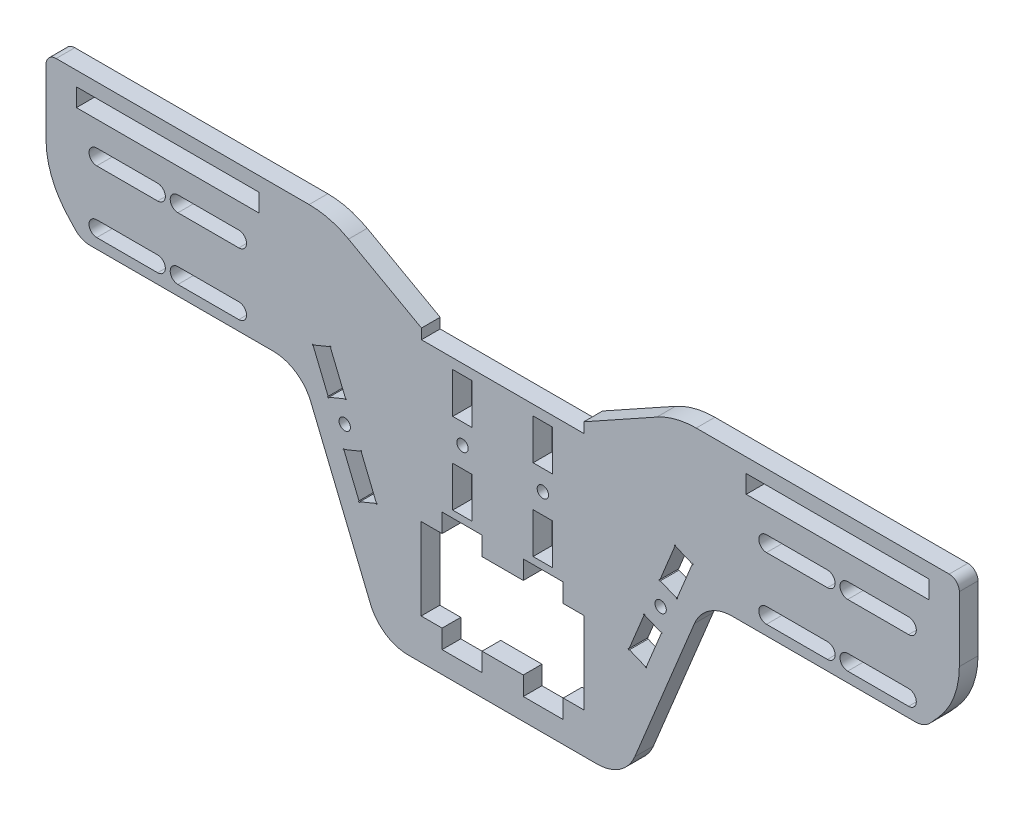
from build123d import *

# Parameters (mm, degrees)
SKETCH1_W           = 57.15
SKETCH1_H           = 5.641999892
BOSS_EXTRUDE1_DEPTH = 5.842
FILLET1_R           = 12.7
FILLET2_R           = 6.35
FILLET3_R           = 25.4
FILLET4_R           = 3.175
FILLET5_R           = 25.4
SKETCH2_R           = 1.778
SKETCH2_W           = 6.096
SKETCH2_H           = 12.7
CUT_EXTRUDE1_DEPTH  = 165.420046831
SKETCH4_W           = 5.842
SKETCH4_H           = 12.5
BOSS_EXTRUDE2_DEPTH = 5.842
SKETCH6_R           = 0.1984375
SKETCH6_R_2         = 1.778
CUT_EXTRUDE4_DEPTH  = 165.420046831


with BuildPart() as part:
    # Sketch1 → Boss-Extrude1 (new body)
    with BuildSketch(Plane.XY):
        Polygon((25.4, 65.274952), (53.975, 81.157607228), (142.875, 81.157607228), (142.875, 47.850552), (131.9276, 35.810952), (63.246, 35.810952), (38.099924, -25.399924), (-38.099924, -25.399924), (-63.246, 35.810952), (-131.9276, 35.810952), (-142.875, 47.850552), (-142.875, 81.157607228), (-53.975, 81.157607228), (-25.4, 65.274952), (-25.4, 62.099952), (25.4, 62.099952), align=None)
        Polygon((6.45, -12.8), (-6.45, -12.8), (-6.45, -18.642), (-18.95, -18.642), (-18.95, -12.8), (-25.5, -12.8), (-25.5, -6.25), (-31.342, -6.25), (-31.342, 6.25), (-25.5, 6.25), (-25.5, 12.8), (-18.95, 12.8), (-18.95, 18.642), (-6.45, 18.642), (-6.45, 12.8), (6.45, 12.8), (6.45, 18.642), (18.95, 18.642), (18.95, 12.8), (25.5, 12.8), (25.5, 6.25), (31.342, 6.25), (31.342, -6.25), (25.5, -6.25), (25.5, -12.8), (18.95, -12.8), (18.95, -18.642), (6.45, -18.642), align=None, mode=Mode.SUBTRACT)
        with BuildLine():
            Line((-82.55, 58.416952), (-101.6, 58.416952))
            ThreePointArc((-101.6, 58.416952), (-104.013, 60.829952), (-101.6, 63.242952))
            Line((-101.6, 63.242952), (-82.55, 63.242952))
            ThreePointArc((-82.55, 63.242952), (-80.137, 60.829952), (-82.55, 58.416952))
        make_face(mode=Mode.SUBTRACT)
        with BuildLine():
            Line((-107.95, 58.416952), (-127, 58.416952))
            ThreePointArc((-127, 58.416952), (-129.413, 60.829952), (-127, 63.242952))
            Line((-127, 63.242952), (-107.95, 63.242952))
            ThreePointArc((-107.95, 63.242952), (-105.537, 60.829952), (-107.95, 58.416952))
        make_face(mode=Mode.SUBTRACT)
        with Locations((-104.775, 73.836351946)):
            Rectangle(SKETCH1_W, SKETCH1_H, mode=Mode.SUBTRACT)
        with BuildLine():
            Line((-82.55, 38.985952), (-101.6, 38.985952))
            ThreePointArc((-101.6, 38.985952), (-104.013, 41.398952), (-101.6, 43.811952))
            Line((-101.6, 43.811952), (-82.55, 43.811952))
            ThreePointArc((-82.55, 43.811952), (-80.137, 41.398952), (-82.55, 38.985952))
        make_face(mode=Mode.SUBTRACT)
        with BuildLine():
            Line((-107.95, 38.985952), (-127, 38.985952))
            ThreePointArc((-127, 38.985952), (-129.413, 41.398952), (-127, 43.811952))
            Line((-127, 43.811952), (-107.95, 43.811952))
            ThreePointArc((-107.95, 43.811952), (-105.537, 41.398952), (-107.95, 38.985952))
        make_face(mode=Mode.SUBTRACT)
        with Locations((104.775, 73.836351946)):
            Rectangle(SKETCH1_W, SKETCH1_H, mode=Mode.SUBTRACT)
        with BuildLine():
            Line((107.95, 38.985952), (127, 38.985952))
            ThreePointArc((127, 38.985952), (129.413, 41.398952), (127, 43.811952))
            Line((127, 43.811952), (107.95, 43.811952))
            ThreePointArc((107.95, 43.811952), (105.537, 41.398952), (107.95, 38.985952))
        make_face(mode=Mode.SUBTRACT)
        with BuildLine():
            Line((82.55, 38.985952), (101.6, 38.985952))
            ThreePointArc((101.6, 38.985952), (104.013, 41.398952), (101.6, 43.811952))
            Line((101.6, 43.811952), (82.55, 43.811952))
            ThreePointArc((82.55, 43.811952), (80.137, 41.398952), (82.55, 38.985952))
        make_face(mode=Mode.SUBTRACT)
        with BuildLine():
            Line((107.95, 58.416952), (127, 58.416952))
            ThreePointArc((127, 58.416952), (129.413, 60.829952), (127, 63.242952))
            Line((127, 63.242952), (107.95, 63.242952))
            ThreePointArc((107.95, 63.242952), (105.537, 60.829952), (107.95, 58.416952))
        make_face(mode=Mode.SUBTRACT)
        with BuildLine():
            Line((82.55, 58.416952), (101.6, 58.416952))
            ThreePointArc((101.6, 58.416952), (104.013, 60.829952), (101.6, 63.242952))
            Line((101.6, 63.242952), (82.55, 63.242952))
            ThreePointArc((82.55, 63.242952), (80.137, 60.829952), (82.55, 58.416952))
        make_face(mode=Mode.SUBTRACT)
    extrude(amount=BOSS_EXTRUDE1_DEPTH)

    # Fillet1
    fillet1_edges = [part.edges().sort_by_distance(p)[0] for p in [
        (-63.246, 35.810952, 2.921),
        (63.246, 35.810952, 2.921),
        (38.099924, -25.399924, 2.921),
        (-38.099924, -25.399924, 2.921),
    ]]
    fillet(fillet1_edges, radius=FILLET1_R)

    # Fillet2
    fillet2_edges = [part.edges().sort_by_distance(p)[0] for p in [
        (-131.9276, 35.810952, 2.921),
        (131.9276, 35.810952, 2.921),
    ]]
    fillet(fillet2_edges, radius=FILLET2_R)

    # Fillet3
    fillet3_edges = [part.edges().sort_by_distance(p)[0] for p in [
        (-142.875, 47.850552, 2.921),
        (142.875, 47.850552, 2.921),
    ]]
    fillet(fillet3_edges, radius=FILLET3_R)

    # Fillet4
    fillet4_edges = [part.edges().sort_by_distance(p)[0] for p in [
        (-142.875, 81.157607228, 2.921),
        (142.875, 81.157607228, 2.921),
    ]]
    fillet(fillet4_edges, radius=FILLET4_R)

    # Fillet5
    fillet5_edges = [part.edges().sort_by_distance(p)[0] for p in [
        (-53.975, 81.157607228, 2.921),
        (53.975, 81.157607228, 2.921),
    ]]
    fillet(fillet5_edges, radius=FILLET5_R)

    # Sketch2 → Cut-Extrude1 (cut, through all)
    with BuildSketch(Plane.XY.offset(5.842)):
        with Locations((-12.573, 39.874952)):
            Circle(SKETCH2_R)
        with Locations(Location((12.573, 39.874952, 0), (0, 0, 180))):
            Circle(SKETCH2_R)
        with Locations((-12.573, 27.174952)):
            Rectangle(SKETCH2_W, SKETCH2_H)
        with Locations((-12.573, 52.574952)):
            Rectangle(SKETCH2_W, SKETCH2_H)
        with Locations((12.573, 27.174952)):
            Rectangle(SKETCH2_W, SKETCH2_H)
        with Locations((12.573, 52.574952)):
            Rectangle(SKETCH2_W, SKETCH2_H)
    extrude(amount=-CUT_EXTRUDE1_DEPTH, mode=Mode.SUBTRACT)

    # Sketch4 → Boss-Extrude2 (add)
    with BuildSketch(Plane.XY.offset(5.842)):
        with Locations((28.421, 0)):
            Rectangle(SKETCH4_W, SKETCH4_H)
        with Locations((-28.421, 0)):
            Rectangle(SKETCH4_W, SKETCH4_H)
    extrude(amount=-BOSS_EXTRUDE2_DEPTH)

    # Sketch6 → Cut-Extrude4 (cut, through all)
    with BuildSketch(Plane.XY.offset(5.842)):
        with Locations((49.126015051, 34.192973557)):
            Circle(SKETCH6_R)
        with Locations((54.529797926, 31.973042333)):
            Circle(SKETCH6_R)
        with Locations((59.355735369, 43.720396409)):
            Circle(SKETCH6_R)
        with Locations((53.951952494, 45.940327633)):
            Circle(SKETCH6_R)
        Polygon((54.529797926, 31.973042333), (49.126015051, 34.192973557), (53.951952494, 45.940327633), (59.355735369, 43.720396409), align=None)
        with BuildLine():
            Line((49.309567458, 34.117568284), (49.126015051, 34.192973557))
            Line((49.126015051, 34.192973557), (49.201420323, 34.376525964))
            ThreePointArc((49.201420323, 34.376525964), (48.942904319, 34.116501984), (49.309567458, 34.117568284))
        make_face()
        with BuildLine():
            Line((49.201420323, 34.376525964), (49.126015051, 34.192973557))
            Line((49.126015051, 34.192973557), (49.309567458, 34.117568284))
            ThreePointArc((49.309567458, 34.117568284), (49.320695715, 34.154543357), (49.324452551, 34.192973557))
            ThreePointArc((49.324452551, 34.192973557), (49.290849324, 34.30345932), (49.201420323, 34.376525964))
        make_face()
        with BuildLine():
            ThreePointArc((54.605203199, 32.15659474), (54.453326354, 32.156153065), (54.346245519, 32.048447606))
            Line((54.346245519, 32.048447606), (54.529797926, 31.973042333))
            Line((54.529797926, 31.973042333), (54.605203199, 32.15659474))
        make_face()
        with BuildLine():
            Line((54.529797926, 31.973042333), (54.346245519, 32.048447606))
            ThreePointArc((54.346245519, 32.048447606), (54.491367726, 31.778361669), (54.728235426, 31.973042333))
            ThreePointArc((54.728235426, 31.973042333), (54.694632199, 32.083528096), (54.605203199, 32.15659474))
            Line((54.605203199, 32.15659474), (54.529797926, 31.973042333))
        make_face()
        with BuildLine():
            ThreePointArc((54.150389994, 45.940327633), (53.841466731, 46.105161906), (53.876547221, 45.756775226))
            Line((53.876547221, 45.756775226), (53.951952494, 45.940327633))
            Line((53.951952494, 45.940327633), (54.135504901, 45.864922361))
            ThreePointArc((54.135504901, 45.864922361), (54.146633158, 45.901897433), (54.150389994, 45.940327633))
        make_face()
        with BuildLine():
            Line((53.951952494, 45.940327633), (53.876547221, 45.756775226))
            ThreePointArc((53.876547221, 45.756775226), (54.028424066, 45.757216902), (54.135504901, 45.864922361))
            Line((54.135504901, 45.864922361), (53.951952494, 45.940327633))
        make_face()
        with BuildLine():
            ThreePointArc((59.554172869, 43.720396409), (59.394165569, 43.915077074), (59.172182962, 43.795801682))
            Line((59.172182962, 43.795801682), (59.355735369, 43.720396409))
            Line((59.355735369, 43.720396409), (59.280330096, 43.536844002))
            ThreePointArc((59.280330096, 43.536844002), (59.466221132, 43.555562136), (59.554172869, 43.720396409))
        make_face()
        with BuildLine():
            Line((59.355735369, 43.720396409), (59.172182962, 43.795801682))
            ThreePointArc((59.172182962, 43.795801682), (59.172624637, 43.643924837), (59.280330096, 43.536844002))
            Line((59.280330096, 43.536844002), (59.355735369, 43.720396409))
        make_face()
        with Locations((49.703860483, 20.225688257)):
            Circle(SKETCH6_R)
        with Locations((44.300077608, 22.44561948)):
            Circle(SKETCH6_R)
        with Locations((39.474140165, 10.698265404)):
            Circle(SKETCH6_R)
        with Locations((44.87792304, 8.47833418)):
            Circle(SKETCH6_R)
        Polygon((49.703860483, 20.225688257), (44.300077608, 22.44561948), (39.474140165, 10.698265404), (44.87792304, 8.47833418), align=None)
        with Locations((49.414937767, 27.209330907)):
            Circle(SKETCH6_R_2)
        with BuildLine():
            ThreePointArc((45.07636054, 8.47833418), (45.042757313, 8.588819943), (44.953328313, 8.661886588))
            Line((44.953328313, 8.661886588), (44.87792304, 8.47833418))
            Line((44.87792304, 8.47833418), (44.694370633, 8.553739453))
            ThreePointArc((44.694370633, 8.553739453), (44.83949284, 8.283653516), (45.07636054, 8.47833418))
        make_face()
        with BuildLine():
            Line((44.87792304, 8.47833418), (44.953328313, 8.661886588))
            ThreePointArc((44.953328313, 8.661886588), (44.801451468, 8.661444912), (44.694370633, 8.553739453))
            Line((44.694370633, 8.553739453), (44.87792304, 8.47833418))
        make_face()
        with BuildLine():
            ThreePointArc((39.549545438, 10.881817811), (39.291029433, 10.621793832), (39.657692572, 10.622860131))
            Line((39.657692572, 10.622860131), (39.474140165, 10.698265404))
            Line((39.474140165, 10.698265404), (39.549545438, 10.881817811))
        make_face()
        with BuildLine():
            Line((39.474140165, 10.698265404), (39.657692572, 10.622860131))
            ThreePointArc((39.657692572, 10.622860131), (39.668820829, 10.659835204), (39.672577665, 10.698265404))
            ThreePointArc((39.672577665, 10.698265404), (39.638974438, 10.808751167), (39.549545438, 10.881817811))
            Line((39.549545438, 10.881817811), (39.474140165, 10.698265404))
        make_face()
        with BuildLine():
            ThreePointArc((44.224672335, 22.262067073), (44.37654918, 22.262508749), (44.483630015, 22.370214208))
            Line((44.483630015, 22.370214208), (44.300077608, 22.44561948))
            Line((44.300077608, 22.44561948), (44.224672335, 22.262067073))
        make_face()
        with BuildLine():
            Line((44.300077608, 22.44561948), (44.483630015, 22.370214208))
            ThreePointArc((44.483630015, 22.370214208), (44.494758272, 22.40718928), (44.498515108, 22.44561948))
            ThreePointArc((44.498515108, 22.44561948), (44.189591845, 22.610453753), (44.224672335, 22.262067073))
            Line((44.224672335, 22.262067073), (44.300077608, 22.44561948))
        make_face()
        with BuildLine():
            Line((49.628455211, 20.042135849), (49.703860483, 20.225688257))
            Line((49.703860483, 20.225688257), (49.520308076, 20.301093529))
            ThreePointArc((49.520308076, 20.301093529), (49.520749752, 20.149216684), (49.628455211, 20.042135849))
        make_face()
        with BuildLine():
            Line((49.520308076, 20.301093529), (49.703860483, 20.225688257))
            Line((49.703860483, 20.225688257), (49.628455211, 20.042135849))
            ThreePointArc((49.628455211, 20.042135849), (49.814346246, 20.060853984), (49.902297983, 20.225688257))
            ThreePointArc((49.902297983, 20.225688257), (49.742290683, 20.420368921), (49.520308076, 20.301093529))
        make_face()
    cut_extrude4 = extrude(amount=-CUT_EXTRUDE4_DEPTH, mode=Mode.SUBTRACT)

    # Mirror1: Cut-Extrude4 across plane
    add(cut_extrude4.mirror(Plane.ZY), mode=Mode.SUBTRACT)


solid = part.part
